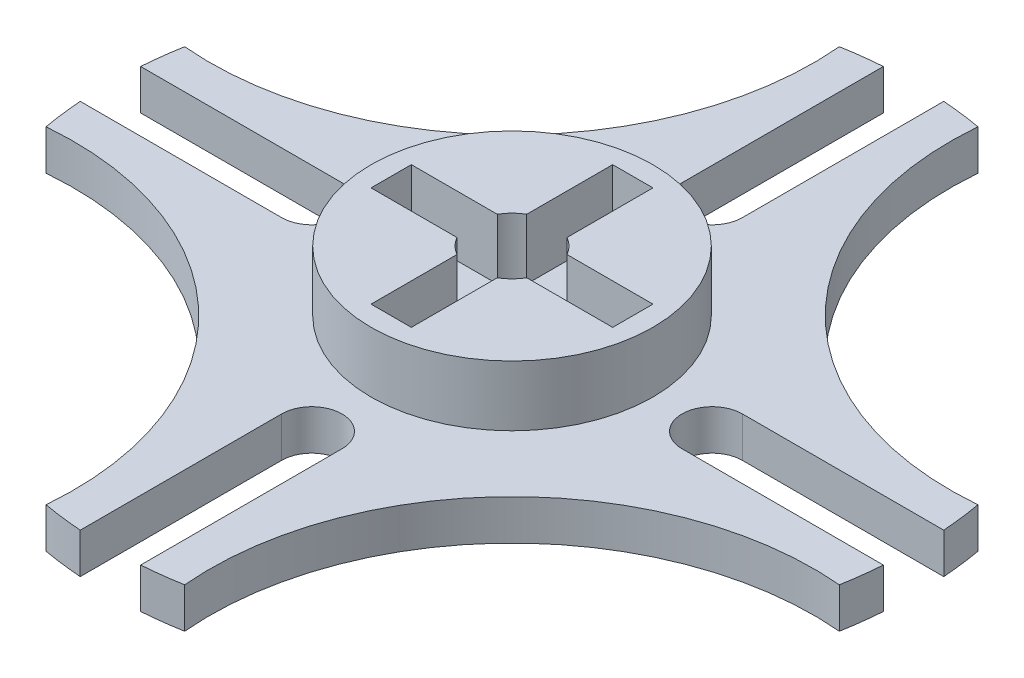
from build123d import *

# Parameters (mm, degrees)
BOSS_EXTRUDE3_DEPTH = 10
SKETCH2_R           = 35
BOSS_EXTRUDE4_DEPTH = 15


with BuildPart() as part:
    # Sketch1 → Boss-Extrude3 (new body)
    with BuildSketch(Plane(origin=(0, 0, 0), x_dir=(1, 0, 0), z_dir=(0, 1, 0))):
        with BuildLine():
            Line((-7.5, 49.718353376), (-7.5, 99.718353376))
            ThreePointArc((-7.5, 99.718353376), (-12.371520282, 99.231776594), (-17.213387926, 98.507356457))
            ThreePointArc((-17.213387926, 98.507356457), (-38.890872965, 38.890872965), (-98.507356457, 17.213387926))
            ThreePointArc((-98.507356457, 17.213387926), (-99.231776594, 12.371520282), (-99.718353376, 7.5))
            Line((-99.718353376, 7.5), (-49.718353376, 7.5))
            ThreePointArc((-49.718353376, 7.5), (-42.218353376, 0), (-49.718353376, -7.5))
            Line((-49.718353376, -7.5), (-99.718353376, -7.5))
            ThreePointArc((-99.718353376, -7.5), (-99.231776594, -12.371520282), (-98.507356457, -17.213387926))
            ThreePointArc((-98.507356457, -17.213387926), (-38.890872965, -38.890872965), (-17.213387926, -98.507356457))
            ThreePointArc((-17.213387926, -98.507356457), (-12.371520282, -99.231776594), (-7.5, -99.718353376))
            Line((-7.5, -99.718353376), (-7.5, -49.718353376))
            ThreePointArc((-7.5, -49.718353376), (0, -42.218353376), (7.5, -49.718353376))
            Line((7.5, -49.718353376), (7.5, -99.718353376))
            ThreePointArc((7.5, -99.718353376), (12.371520282, -99.231776594), (17.213387926, -98.507356457))
            ThreePointArc((17.213387926, -98.507356457), (38.890872965, -38.890872965), (98.507356457, -17.213387926))
            ThreePointArc((98.507356457, -17.213387926), (99.231776594, -12.371520282), (99.718353376, -7.5))
            Line((99.718353376, -7.5), (49.718353376, -7.5))
            ThreePointArc((49.718353376, -7.5), (42.218353376, 0), (49.718353376, 7.5))
            Line((49.718353376, 7.5), (99.718353376, 7.5))
            ThreePointArc((99.718353376, 7.5), (99.231776594, 12.371520282), (98.507356457, 17.213387926))
            ThreePointArc((98.507356457, 17.213387926), (38.890872965, 38.890872965), (17.213387926, 98.507356457))
            ThreePointArc((17.213387926, 98.507356457), (12.371520282, 99.231776594), (7.5, 99.718353376))
            Line((7.5, 99.718353376), (7.5, 49.718353376))
            ThreePointArc((7.5, 49.718353376), (0, 42.218353376), (-7.5, 49.718353376))
        make_face()
    extrude(amount=BOSS_EXTRUDE3_DEPTH)

    # Sketch2 → Boss-Extrude4 (add)
    with BuildSketch(Plane(origin=(0, 10, 0), x_dir=(1, 0, 0), z_dir=(0, 1, 0))):
        with Locations(Location((0, 0, 0), (0, 0, 270))):
            Circle(SKETCH2_R)
        with BuildLine():
            Line((-5, 8.660254038), (-5, 30))
            Line((-5, 30), (5, 30))
            Line((5, 30), (5, 8.660254038))
            ThreePointArc((5, 8.660254038), (7.071067812, 7.071067812), (8.660254038, 5))
            Line((8.660254038, 5), (30, 5))
            Line((30, 5), (30, -5))
            Line((30, -5), (8.660254038, -5))
            ThreePointArc((8.660254038, -5), (7.071067812, -7.071067812), (5, -8.660254038))
            Line((5, -8.660254038), (5, -30))
            Line((5, -30), (-5, -30))
            Line((-5, -30), (-5, -8.660254038))
            ThreePointArc((-5, -8.660254038), (-7.071067812, -7.071067812), (-8.660254038, -5))
            Line((-8.660254038, -5), (-30, -5))
            Line((-30, -5), (-30, 5))
            Line((-30, 5), (-8.660254038, 5))
            ThreePointArc((-8.660254038, 5), (-7.071067812, 7.071067812), (-5, 8.660254038))
        make_face(mode=Mode.SUBTRACT)
    extrude(amount=BOSS_EXTRUDE4_DEPTH)


solid = part.part
